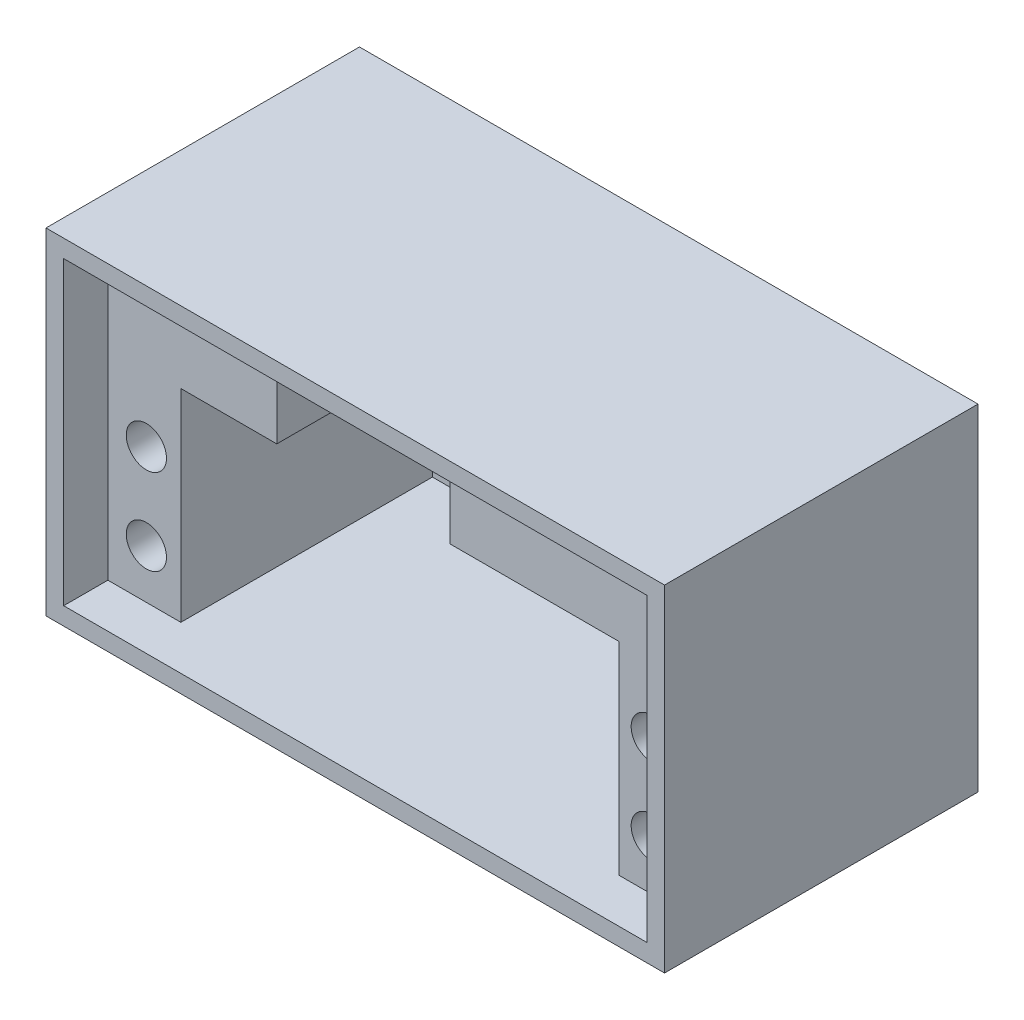
from build123d import *

# Parameters (mm, degrees)
SKETCH1_W           = 8.25
SKETCH1_H           = 2.1
SKETCH1_H_2         = 20.8
SKETCH1_R           = 2.275
BOSS_EXTRUDE1_DEPTH = 28.45
BOSS_EXTRUDE2_START = -28.45
SKETCH1_4_W         = 8.25
SKETCH1_4_H         = 2.1
SKETCH1_4_H_2       = 20.8
SKETCH1_4_R         = 2.275
SKETCH1_4_W_2       = 40.9
SKETCH1_4_W_3       = 0.2
SKETCH1_4_W_4       = 8.45
SKETCH1_4_R_2       = 1.7
BOSS_EXTRUDE2_DEPTH = 2
SKETCH1_5_W         = 69.95
SKETCH1_5_H         = 38
BOSS_EXTRUDE3_DEPTH = 30.45
SKETCH1_6_W         = 69.95
SKETCH1_6_H         = 38
BOSS_EXTRUDE4_DEPTH = 5


with BuildPart() as part:
    # Sketch1 → Boss-Extrude1 (new body)
    # profile 1 of 5: a face of its own
    with BuildSketch(Plane.XY):
        Polygon((-28.9, 12.5), (-20.65, 12.5), (-9.8, 12.5), (-9.8, 23.6), (-28.9, 23.6), align=None)
    # profile 2 of 5: a face of its own
    with BuildSketch(Plane.XY):
        with Locations((-24.775, 11.45)):
            Rectangle(SKETCH1_W, SKETCH1_H)
    # profile 3 of 5: a face of its own
    with BuildSketch(Plane.XY):
        with Locations((-24.775, 0)):
            Rectangle(SKETCH1_W, SKETCH1_H_2)
        with Locations((-24.55, -4.85)):
            Circle(SKETCH1_R, mode=Mode.SUBTRACT)
        with Locations((-24.55, 4.85)):
            Circle(SKETCH1_R, mode=Mode.SUBTRACT)
    # profile 4 of 5: a face of its own
    with BuildSketch(Plane.XY):
        Polygon((9.8, 12.5), (20.45, 12.5), (28.9, 12.5), (37.05, 12.5), (37.05, 23.6), (9.8, 23.6), align=None)
    # profile 5 of 5: a face of its own
    with BuildSketch(Plane.XY):
        Polygon((28.9, 12.5), (28.9, 10.4), (28.9, -10.4), (37.05, -10.4), (37.05, 12.5), align=None)
        with Locations((32.55, -4.85)):
            Circle(SKETCH1_R, mode=Mode.SUBTRACT)
        with Locations((32.55, 4.85)):
            Circle(SKETCH1_R, mode=Mode.SUBTRACT)
    extrude(amount=-BOSS_EXTRUDE1_DEPTH)

    # Sketch1<4> → Boss-Extrude2 (add)
    # profile 1 of 16: a face of its own
    with BuildSketch(Plane.XY.offset(BOSS_EXTRUDE2_START)):
        Polygon((-28.9, 12.5), (-20.65, 12.5), (-9.8, 12.5), (-9.8, 23.6), (-28.9, 23.6), align=None)
    # profile 2 of 16: a face of its own
    with BuildSketch(Plane.XY.offset(BOSS_EXTRUDE2_START)):
        Polygon((9.8, 12.5), (20.45, 12.5), (28.9, 12.5), (37.05, 12.5), (37.05, 23.6), (9.8, 23.6), align=None)
    # profile 3 of 16: a face of its own
    with BuildSketch(Plane.XY.offset(BOSS_EXTRUDE2_START)):
        Polygon((-20.65, 10.4), (-20.45, 10.4), (20.45, 10.4), (20.45, 12.5), (9.8, 12.5), (-9.8, 12.5), (-20.65, 12.5), align=None)
    # profile 4 of 16: a face of its own
    with BuildSketch(Plane.XY.offset(BOSS_EXTRUDE2_START)):
        with Locations((-24.775, 11.45)):
            Rectangle(SKETCH1_4_W, SKETCH1_4_H)
    # profile 5 of 16: a face of its own
    with BuildSketch(Plane.XY.offset(BOSS_EXTRUDE2_START)):
        with Locations((-24.775, 0)):
            Rectangle(SKETCH1_4_W, SKETCH1_4_H_2)
        with Locations((-24.55, -4.85)):
            Circle(SKETCH1_4_R, mode=Mode.SUBTRACT)
        with Locations((-24.55, 4.85)):
            Circle(SKETCH1_4_R, mode=Mode.SUBTRACT)
    # profile 6 of 16: a face of its own
    with BuildSketch(Plane.XY.offset(BOSS_EXTRUDE2_START)):
        with Locations((-24.55, 4.85)):
            Circle(SKETCH1_4_R)
    # profile 7 of 16: a face of its own
    with BuildSketch(Plane.XY.offset(BOSS_EXTRUDE2_START)):
        with Locations((-24.55, -4.85)):
            Circle(SKETCH1_4_R)
    # profile 8 of 16: a face of its own
    with BuildSketch(Plane.XY.offset(BOSS_EXTRUDE2_START)):
        Rectangle(SKETCH1_4_W_2, SKETCH1_4_H_2)
    # profile 9 of 16: a face of its own
    with BuildSketch(Plane.XY.offset(BOSS_EXTRUDE2_START)):
        with Locations((-20.55, 0)):
            Rectangle(SKETCH1_4_W_3, SKETCH1_4_H_2)
    # profile 10 of 16: a face of its own
    with BuildSketch(Plane.XY.offset(BOSS_EXTRUDE2_START)):
        with Locations((24.675, 0)):
            Rectangle(SKETCH1_4_W_4, SKETCH1_4_H_2)
        with Locations((24.55, -4.85)):
            Circle(SKETCH1_4_R_2, mode=Mode.SUBTRACT)
        with Locations((24.55, 4.85)):
            Circle(SKETCH1_4_R_2, mode=Mode.SUBTRACT)
    # profile 11 of 16: a face of its own
    with BuildSketch(Plane.XY.offset(BOSS_EXTRUDE2_START)):
        with Locations((24.55, 4.85)):
            Circle(SKETCH1_4_R_2)
    # profile 12 of 16: a face of its own
    with BuildSketch(Plane.XY.offset(BOSS_EXTRUDE2_START)):
        with Locations((24.55, -4.85)):
            Circle(SKETCH1_4_R_2)
    # profile 13 of 16: a face of its own
    with BuildSketch(Plane.XY.offset(BOSS_EXTRUDE2_START)):
        with Locations((24.675, 11.45)):
            Rectangle(SKETCH1_4_W_4, SKETCH1_4_H)
    # profile 14 of 16: a face of its own
    with BuildSketch(Plane.XY.offset(BOSS_EXTRUDE2_START)):
        Polygon((28.9, 12.5), (28.9, 10.4), (28.9, -10.4), (37.05, -10.4), (37.05, 12.5), align=None)
        with Locations((32.55, -4.85)):
            Circle(SKETCH1_4_R, mode=Mode.SUBTRACT)
        with Locations((32.55, 4.85)):
            Circle(SKETCH1_4_R, mode=Mode.SUBTRACT)
    # profile 15 of 16: a face of its own
    with BuildSketch(Plane.XY.offset(BOSS_EXTRUDE2_START)):
        with Locations((32.55, 4.85)):
            Circle(SKETCH1_4_R)
    # profile 16 of 16: a face of its own
    with BuildSketch(Plane.XY.offset(BOSS_EXTRUDE2_START)):
        with Locations((32.55, -4.85)):
            Circle(SKETCH1_4_R)
    extrude(amount=-BOSS_EXTRUDE2_DEPTH)

    # Sketch1<5> → Boss-Extrude3 (add)
    with BuildSketch(Plane.XY):
        with Locations((4.075, 6.6)):
            Rectangle(SKETCH1_5_W, SKETCH1_5_H)
        Polygon((37.05, 23.6), (9.8, 23.6), (-9.8, 23.6), (-28.9, 23.6), (-28.9, 12.5), (-28.9, 10.4), (-28.9, -10.4), (28.9, -10.4), (37.05, -10.4), (37.05, 12.5), align=None, mode=Mode.SUBTRACT)
    extrude(amount=-BOSS_EXTRUDE3_DEPTH)

    # Sketch1<6> → Boss-Extrude4 (add)
    with BuildSketch(Plane.XY):
        with Locations((4.075, 6.6)):
            Rectangle(SKETCH1_6_W, SKETCH1_6_H)
        Polygon((37.05, 23.6), (9.8, 23.6), (-9.8, 23.6), (-28.9, 23.6), (-28.9, 12.5), (-28.9, 10.4), (-28.9, -10.4), (28.9, -10.4), (37.05, -10.4), (37.05, 12.5), align=None, mode=Mode.SUBTRACT)
    extrude(amount=BOSS_EXTRUDE4_DEPTH)


solid = part.part
